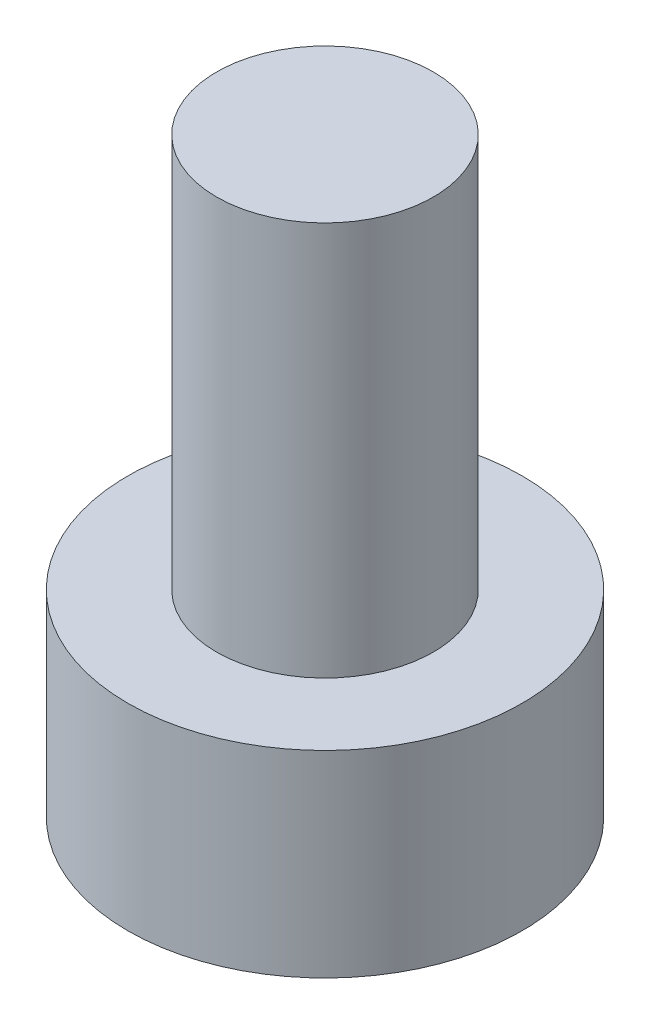
from build123d import *

# Parameters (mm, degrees)
SKETCH1_R           = 2
BOSS_EXTRUDE1_DEPTH = 2
CUT_EXTRUDE1_DEPTH  = 1
SKETCH3_R           = 1.1
BOSS_EXTRUDE2_DEPTH = 4


with BuildPart() as part:
    # Sketch1 → Boss-Extrude1 (new body)
    with BuildSketch(Plane(origin=(0, 0, 0), x_dir=(1, 0, 0), z_dir=(0, 1, 0))):
        with Locations(Location((0, 0, 0), (0, 0, 270))):
            Circle(SKETCH1_R)
    extrude(amount=BOSS_EXTRUDE1_DEPTH)

    # Sketch2 → Cut-Extrude1 (cut)
    with BuildSketch(Plane.XZ):
        Polygon((1.30710226, -0.116595976), (0.754526207, 1.073685774), (-0.552576053, 1.190281751), (-1.30710226, 0.116595976), (-0.754526207, -1.073685774), (0.552576053, -1.190281751), align=None)
    extrude(amount=-CUT_EXTRUDE1_DEPTH, mode=Mode.SUBTRACT)

    # Sketch3 → Boss-Extrude2 (add)
    with BuildSketch(Plane(origin=(0, 2, 0), x_dir=(1, 0, 0), z_dir=(0, 1, 0))):
        with Locations(Location((0, 0, 0), (0, 0, 270))):
            Circle(SKETCH3_R)
    extrude(amount=BOSS_EXTRUDE2_DEPTH)


solid = part.part
